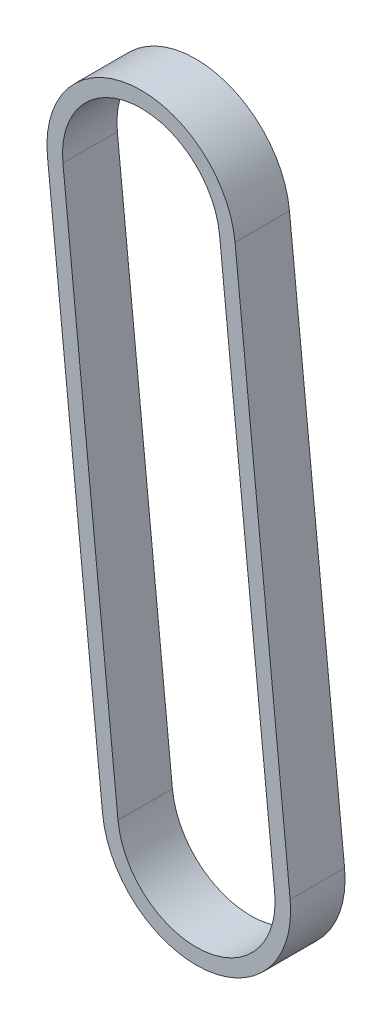
from build123d import *

# Parameters (mm, degrees)
EXTRUDE_1_DEPTH = 3.5


with BuildPart() as part:
    # 草图2 → 拉伸-薄壁1 (new, symmetric)
    with BuildSketch(Plane.XY):
        with BuildLine():
            Line((-17.685848075, 31.687324184), (-10.603503828, -37.953471331))
            ThreePointArc((-10.603503828, -37.953471331), (-21.439521279, -51.243015183), (-34.729065131, -40.406997732))
            Line((-34.729065131, -40.406997732), (-41.811409379, 29.233797783))
            ThreePointArc((-41.811409379, 29.233797783), (-30.975391927, 42.523341635), (-17.685848075, 31.687324184))
        make_face()
        with BuildLine():
            Line((-19.67558509, 31.484971491), (-12.593240843, -38.155824024))
            ThreePointArc((-12.593240843, -38.155824024), (-21.641873972, -49.253278168), (-32.739328117, -40.204645039))
            Line((-32.739328117, -40.204645039), (-39.821672364, 29.436150476))
            ThreePointArc((-39.821672364, 29.436150476), (-30.773039234, 40.53360462), (-19.67558509, 31.484971491))
        make_face(mode=Mode.SUBTRACT)
    extrude(amount=EXTRUDE_1_DEPTH, both=True)


solid = part.part
